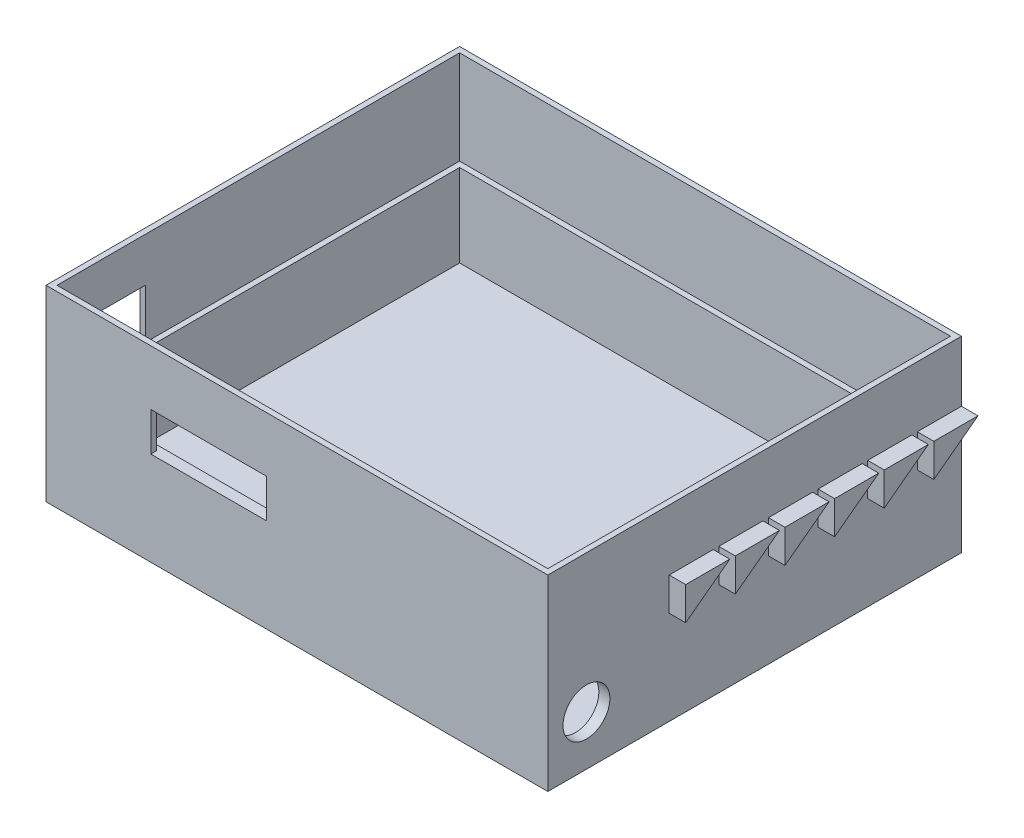
from build123d import *

# Parameters (mm, degrees)
SKETCH_1_W          = 87
SKETCH_1_H          = 71
EXTRUDE_1_DEPTH     = 2
SKETCH_2_W          = 91
SKETCH_2_H          = 75
SKETCH_2_W_2        = 87
SKETCH_2_H_2        = 71
EXTRUDE_2_DEPTH     = 17
SKETCH_3_R          = 4.25
CUT_EXTRUDE_2_DEPTH = 17
SKETCH_4_W          = 91
SKETCH_4_H          = 75
SKETCH_4_W_2        = 89
SKETCH_4_H_2        = 73
EXTRUDE_3_DEPTH     = 17
SKETCH_6_W          = 16
SKETCH_6_H          = 9
CUT_EXTRUDE_3_DEPTH = 17
SKETCH_7_W          = 21
SKETCH_7_H          = 7
CUT_EXTRUDE_4_DEPTH = 17
EXTRUDE_4_DEPTH     = 3
EXTRUDE_5_DEPTH     = 3


with BuildPart() as part:
    # 草图1 → 凸台-拉伸1 (new body)
    with BuildSketch(Plane(origin=(0, 0, 0), x_dir=(1, 0, 0), z_dir=(0, 1, 0))):
        Rectangle(SKETCH_1_W, SKETCH_1_H)
    extrude(amount=EXTRUDE_1_DEPTH)

    # 草图2 → 凸台-拉伸2 (add)
    with BuildSketch(Plane(origin=(0, 0, 0), x_dir=(1, 0, 0), z_dir=(0, 1, 0))):
        Rectangle(SKETCH_2_W, SKETCH_2_H)
        Rectangle(SKETCH_2_W_2, SKETCH_2_H_2, mode=Mode.SUBTRACT)
    extrude(amount=EXTRUDE_2_DEPTH)

    # 草图3 → 切除-拉伸2 (cut)
    with BuildSketch(Plane(origin=(45.5, 0, 0), x_dir=(0, 0, -1), z_dir=(1, 0, 0))):
        with Locations((-30.5, 9)):
            Circle(SKETCH_3_R)
    extrude(amount=-CUT_EXTRUDE_2_DEPTH, mode=Mode.SUBTRACT)

    # 草图4 → 凸台-拉伸3 (add)
    with BuildSketch(Plane(origin=(0, 17, 0), x_dir=(1, 0, 0), z_dir=(0, 1, 0))):
        Rectangle(SKETCH_4_W, SKETCH_4_H)
        Rectangle(SKETCH_4_W_2, SKETCH_4_H_2, mode=Mode.SUBTRACT)
    extrude(amount=EXTRUDE_3_DEPTH)

    # 草图6 → 切除-拉伸3 (cut)
    with BuildSketch(Plane.ZY.offset(45.5)):
        with Locations((28.5, 21.5)):
            Rectangle(SKETCH_6_W, SKETCH_6_H)
    extrude(amount=-CUT_EXTRUDE_3_DEPTH, mode=Mode.SUBTRACT)

    # 草图7 → 切除-拉伸4 (cut)
    with BuildSketch(Plane.XY.offset(37.5)):
        with Locations((-16, 20.5)):
            Rectangle(SKETCH_7_W, SKETCH_7_H)
    extrude(amount=-CUT_EXTRUDE_4_DEPTH, mode=Mode.SUBTRACT)

    # 草图8 → 凸台-拉伸4 (add)
    with BuildSketch(Plane.ZY.offset(45.5)):
        Polygon((-37.5, 17), (-37.5, 23), (-29.5, 23), align=None)
        Polygon((-20.5, 23), (-28.5, 17), (-28.5, 23), align=None)
        Polygon((-11.5, 23), (-19.5, 17), (-19.5, 23), align=None)
        Polygon((-2.5, 23), (-10.5, 17), (-10.5, 23), align=None)
        Polygon((6.5, 23), (-1.5, 17), (-1.5, 23), align=None)
        Polygon((15.5, 23), (7.5, 17), (7.5, 23), align=None)
    extrude(amount=EXTRUDE_4_DEPTH)

    # 草图9 → 凸台-拉伸5 (add)
    with BuildSketch(Plane(origin=(45.5, 0, 0), x_dir=(0, 0, -1), z_dir=(1, 0, 0))):
        Polygon((37.5, 23), (29.5, 23), (29.5, 17), align=None)
        Polygon((20.5, 17), (28.5, 23), (20.5, 23), align=None)
        Polygon((11.5, 17), (19.5, 23), (11.5, 23), align=None)
        Polygon((2.5, 17), (10.5, 23), (2.5, 23), align=None)
        Polygon((-6.5, 17), (1.5, 23), (-6.5, 23), align=None)
        Polygon((-15.5, 17), (-7.5, 23), (-15.5, 23), align=None)
    extrude(amount=EXTRUDE_5_DEPTH)


solid = part.part
